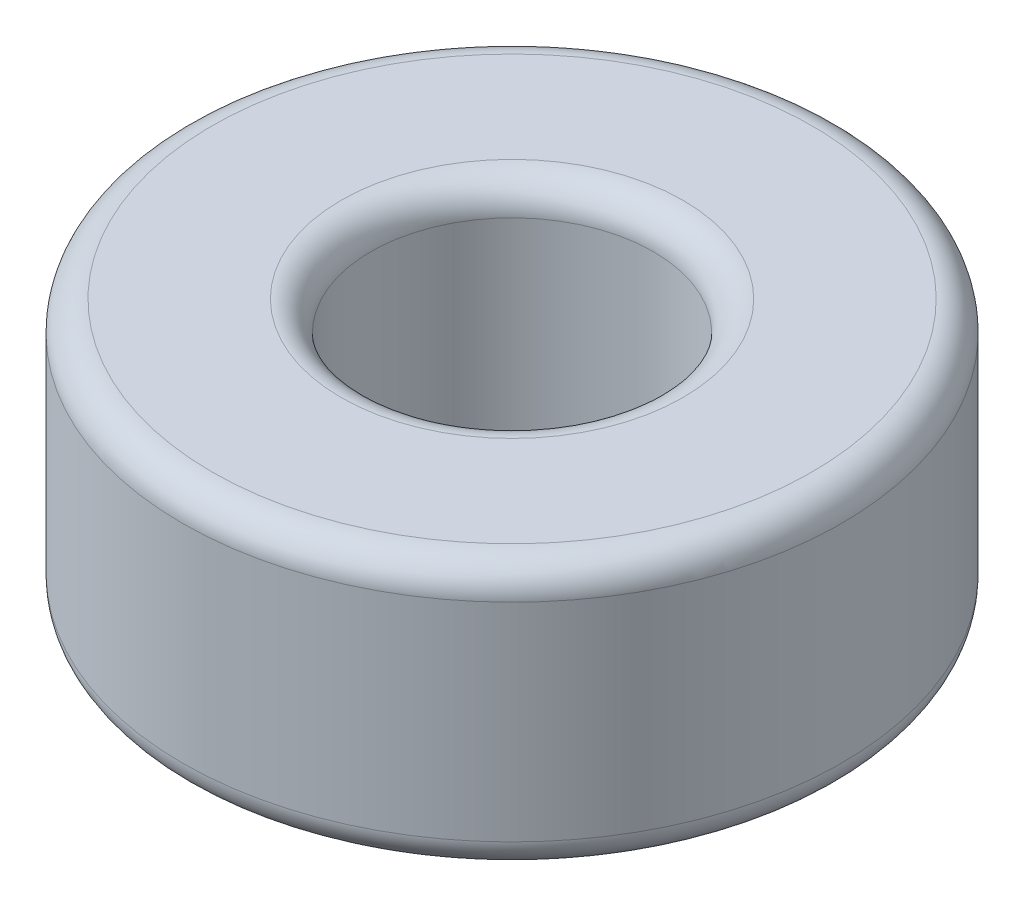
from build123d import *

# Parameters (mm, degrees)
BOSS_EXTRUDE1_DEPTH      = 4.5
BOSS_EXTRUDE1_DEPTH_BACK = 4.5
SKETCH1_R                = 11.1125
SKETCH1_R_2              = 4.7625
FILLET1_R                = 1
FILLET2_R                = 1


with BuildPart() as part:
    # Sketch1 → Boss-Extrude1 (new, two sides: drawn at the far end of the back side and taken through both)
    with BuildSketch(Plane(origin=(0, 0, 0), x_dir=(1, 0, 0), z_dir=(0, 1, 0)).offset(-BOSS_EXTRUDE1_DEPTH_BACK)):
        Circle(SKETCH1_R)
        Circle(SKETCH1_R_2, mode=Mode.SUBTRACT)
    extrude(amount=BOSS_EXTRUDE1_DEPTH + BOSS_EXTRUDE1_DEPTH_BACK)

    # Fillet1
    fillet1_edges = [part.edges().sort_by_distance(p)[0] for p in [
        (-4.7625, -4.5, 0),
        (-4.7625, 4.5, 0),
    ]]
    fillet(fillet1_edges, radius=FILLET1_R)

    # Fillet2
    fillet2_edges = [part.edges().sort_by_distance(p)[0] for p in [
        (-11.1125, 4.5, 0),
        (-11.1125, -4.5, 0),
    ]]
    fillet(fillet2_edges, radius=FILLET2_R)


solid = part.part
